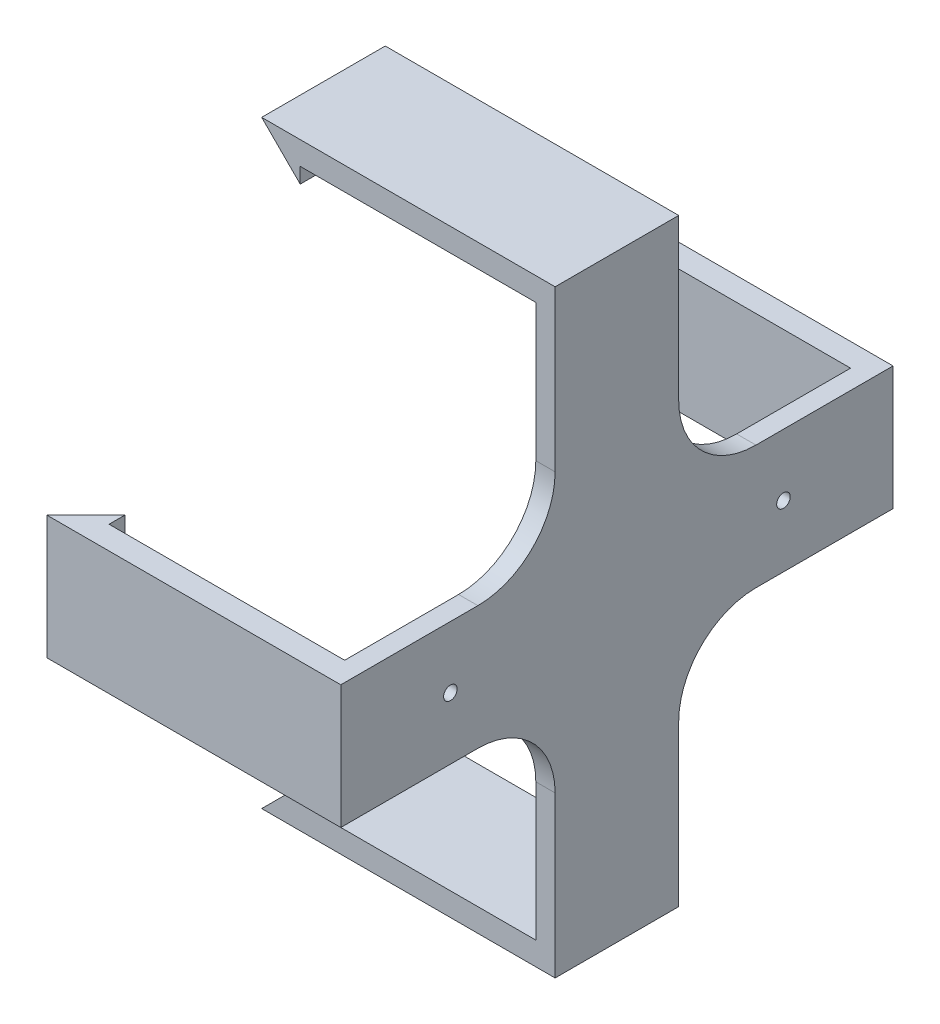
from build123d import *

# Parameters (mm, degrees)
SKETCH2_R           = 2.2225
BOSS_EXTRUDE1_DEPTH = 6.35
SKETCH3_W           = 7.62
SKETCH3_H           = 40.64
SKETCH3_W_2         = 40.64
SKETCH3_H_2         = 7.62
BOSS_EXTRUDE2_DEPTH = 77.47
BOSS_EXTRUDE5_DEPTH = 40.64
BOSS_EXTRUDE6_DEPTH = 40.64
SKETCH8_R           = 3.937
CUT_EXTRUDE1_DEPTH  = 2.54


with BuildPart() as part:
    # Sketch2 → Boss-Extrude1 (new body)
    with BuildSketch(Plane(origin=(0, 0, 0), x_dir=(0, 0, -1), z_dir=(1, 0, 0))):
        with BuildLine():
            Line((-20.32, 98.425), (-20.32, 45.72))
            ThreePointArc((-20.32, 45.72), (-27.759487758, 27.759487758), (-45.72, 20.32))
            Line((-45.72, 20.32), (-90.805, 20.32))
            Line((-90.805, 20.32), (-90.805, -20.32))
            Line((-90.805, -20.32), (-45.72, -20.32))
            ThreePointArc((-45.72, -20.32), (-27.759487758, -27.759487758), (-20.32, -45.72))
            Line((-20.32, -45.72), (-20.32, -98.425))
            Line((-20.32, -98.425), (20.32, -98.425))
            Line((20.32, -98.425), (20.32, -45.72))
            ThreePointArc((20.32, -45.72), (27.759487758, -27.759487758), (45.72, -20.32))
            Line((45.72, -20.32), (90.805, -20.32))
            Line((90.805, -20.32), (90.805, 20.32))
            Line((90.805, 20.32), (45.72, 20.32))
            ThreePointArc((45.72, 20.32), (27.759487758, 27.759487758), (20.32, 45.72))
            Line((20.32, 45.72), (20.32, 98.425))
            Line((20.32, 98.425), (-20.32, 98.425))
        make_face()
        with Locations((54.765086962, 0)):
            Circle(SKETCH2_R, mode=Mode.SUBTRACT)
        with Locations((-54.765086962, 0)):
            Circle(SKETCH2_R, mode=Mode.SUBTRACT)
    extrude(amount=BOSS_EXTRUDE1_DEPTH)

    # Sketch3 → Boss-Extrude2 (add)
    with BuildSketch(Plane.ZY):
        with Locations((-86.995, 0)):
            Rectangle(SKETCH3_W, SKETCH3_H)
        with Locations((0, 94.615)):
            Rectangle(SKETCH3_W_2, SKETCH3_H_2)
        with Locations((86.995, 0)):
            Rectangle(SKETCH3_W, SKETCH3_H)
        with Locations((0, -94.615)):
            Rectangle(SKETCH3_W_2, SKETCH3_H_2)
    extrude(amount=BOSS_EXTRUDE2_DEPTH)

    # Sketch6 → Boss-Extrude5 (add)
    with BuildSketch(Plane(origin=(0, -20.32, 0), x_dir=(-1, 0, 0), z_dir=(0, -1, 0))):
        Polygon((77.47, 90.805), (90.273301898, 90.805), (77.47, 78.001698102), align=None)
        Polygon((90.273301898, -90.805), (77.47, -78.001698102), (77.47, -90.805), align=None)
    extrude(amount=-BOSS_EXTRUDE5_DEPTH)

    # Sketch7 → Boss-Extrude6 (add)
    with BuildSketch(Plane(origin=(0, 0, -20.32), x_dir=(-1, 0, 0), z_dir=(0, 0, -1))):
        Polygon((77.47, -98.425), (90.148305193, -98.425), (77.47, -85.746694807), align=None)
        Polygon((90.148305193, 98.425), (77.47, 85.746694807), (77.47, 98.425), align=None)
    extrude(amount=-BOSS_EXTRUDE6_DEPTH)

    # Sketch8 → Cut-Extrude1 (cut)
    with BuildSketch(Plane.ZY):
        with Locations((54.765086962, 0)):
            Circle(SKETCH8_R)
        with Locations(Location((-54.765086962, 0, 0), (0, 0, 180))):
            Circle(SKETCH8_R)
    extrude(amount=-CUT_EXTRUDE1_DEPTH, mode=Mode.SUBTRACT)


solid = part.part
